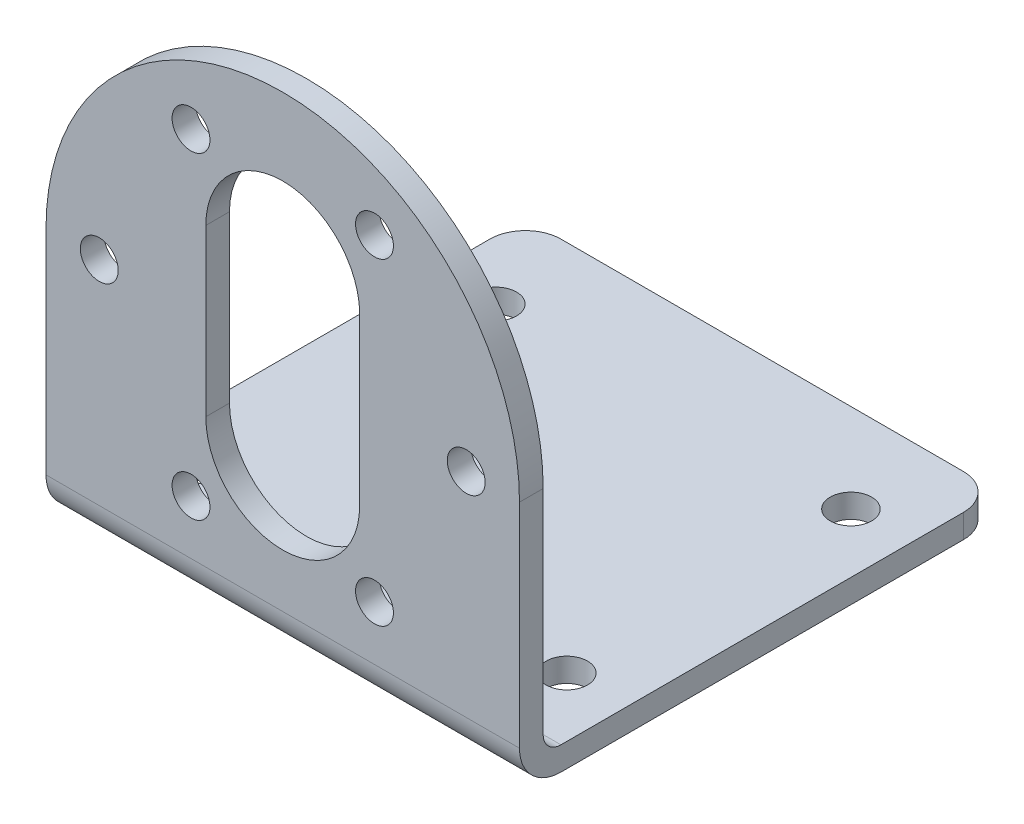
from build123d import *

# Parameters (mm, degrees)
EXTRUDE_1_DEPTH             = 40.5
SKETCH_2_W                  = 38.5
SKETCH_2_H                  = 19.5
CUT_EXTRUDE_1_DEPTH         = 60.752092014
CUT_EXTRUDE_2_DEPTH         = 2
HOLE_WIZARD_3_5_3_5_1_D     = 3.5
HOLE_WIZARD_3_5_3_5_1_DEPTH = 2
HOLE_WIZARD_3_2_3_2_1_D     = 3.2
HOLE_WIZARD_3_2_3_2_1_DEPTH = 40.5
FILLET_1_R                  = 1.5
FILLET_2_R                  = 3
FILLET_3_R                  = 3.5
SKETCH_12_R                 = 1.6
CUT_EXTRUDE_3_DEPTH         = 38.5


with BuildPart() as part:
    # 草图1 → 凸台-拉伸1 (new body)
    with BuildSketch(Plane.XY.offset(20.25)):
        with BuildLine():
            Line((20, -2), (20, 19.5))
            ThreePointArc((20, 19.5), (0, 39.5), (-20, 19.5))
            Line((-20, 19.5), (-20, -2))
            Line((-20, -2), (20, -2))
        make_face()
    extrude(amount=-EXTRUDE_1_DEPTH)

    # 草图2 → 切除-拉伸1 (cut, through all)
    with BuildSketch(Plane(origin=(20, 0, 0), x_dir=(0, 0, -1), z_dir=(1, 0, 0))):
        with Locations((1, 9.75)):
            Rectangle(SKETCH_2_W, SKETCH_2_H)
    extrude(amount=-CUT_EXTRUDE_1_DEPTH, mode=Mode.SUBTRACT)

    # 草图3 → 切除-拉伸2 (cut)
    with BuildSketch(Plane.XY.offset(20.25)):
        with BuildLine():
            Line((-6.5, 26.5), (-6.5, 12.5))
            ThreePointArc((-6.5, 12.5), (0, 6), (6.5, 12.5))
            Line((6.5, 12.5), (6.5, 26.5))
            ThreePointArc((6.5, 26.5), (0, 33), (-6.5, 26.5))
        make_face()
    extrude(amount=-CUT_EXTRUDE_2_DEPTH, mode=Mode.SUBTRACT)

    # Ø3.5 (3.5) 直径孔1
    with Locations(Plane(origin=(0, -2, 0), x_dir=(-1, 0, 0), z_dir=(0, -1, 0))):
        with Locations((15, -11.25), (15, 12.75), (-15, 12.75), (-15, -11.25)):
            Hole(HOLE_WIZARD_3_5_3_5_1_D / 2, depth=HOLE_WIZARD_3_5_3_5_1_DEPTH)

    # Ø3.2 (3.2) 直径孔1
    with Locations(Plane.XY.offset(20.25)):
        with Locations((-7.75, 32.923393759), (-7.75, 6.076606241), (15.5, 19.5), (7.75, 6.076606241), (-15.5, 19.5), (7.75, 32.923393759)):
            Hole(HOLE_WIZARD_3_2_3_2_1_D / 2, depth=HOLE_WIZARD_3_2_3_2_1_DEPTH)

    # 圆角1
    fillet_1_edges = [part.edges().sort_by_distance(p)[0] for p in [
        (0, 0, 18.25),
    ]]
    fillet(fillet_1_edges, radius=FILLET_1_R)

    # 圆角2
    fillet_2_edges = [part.edges().sort_by_distance(p)[0] for p in [
        (-20, -1, -20.25),
        (20, -1, -20.25),
    ]]
    fillet(fillet_2_edges, radius=FILLET_2_R)

    # 圆角3
    fillet_3_edges = [part.edges().sort_by_distance(p)[0] for p in [
        (0, -2, 20.25),
    ]]
    fillet(fillet_3_edges, radius=FILLET_3_R)

    # 草图12 → 切除-拉伸3 (cut)
    with BuildSketch(Plane(origin=(0, 0, -20.25), x_dir=(-1, 0, 0), z_dir=(0, 0, -1))):
        with BuildLine():
            Line((-20, 19.5), (-17.1, 19.5))
            ThreePointArc((-17.1, 19.5), (-15.5, 21.1), (-13.9, 19.5))
            Line((-13.9, 19.5), (13.9, 19.5))
            ThreePointArc((13.9, 19.5), (15.5, 21.1), (17.1, 19.5))
            Line((17.1, 19.5), (20, 19.5))
            ThreePointArc((20, 19.5), (0, 39.5), (-20, 19.5))
        make_face()
        with Locations(Location((-7.75, 32.923393759, 0), (0, 0, 180))):
            Circle(SKETCH_12_R, mode=Mode.SUBTRACT)
        with Locations(Location((7.75, 32.923393759, 0), (0, 0, 180))):
            Circle(SKETCH_12_R, mode=Mode.SUBTRACT)
    extrude(amount=-CUT_EXTRUDE_3_DEPTH, mode=Mode.SUBTRACT)


solid = part.part
